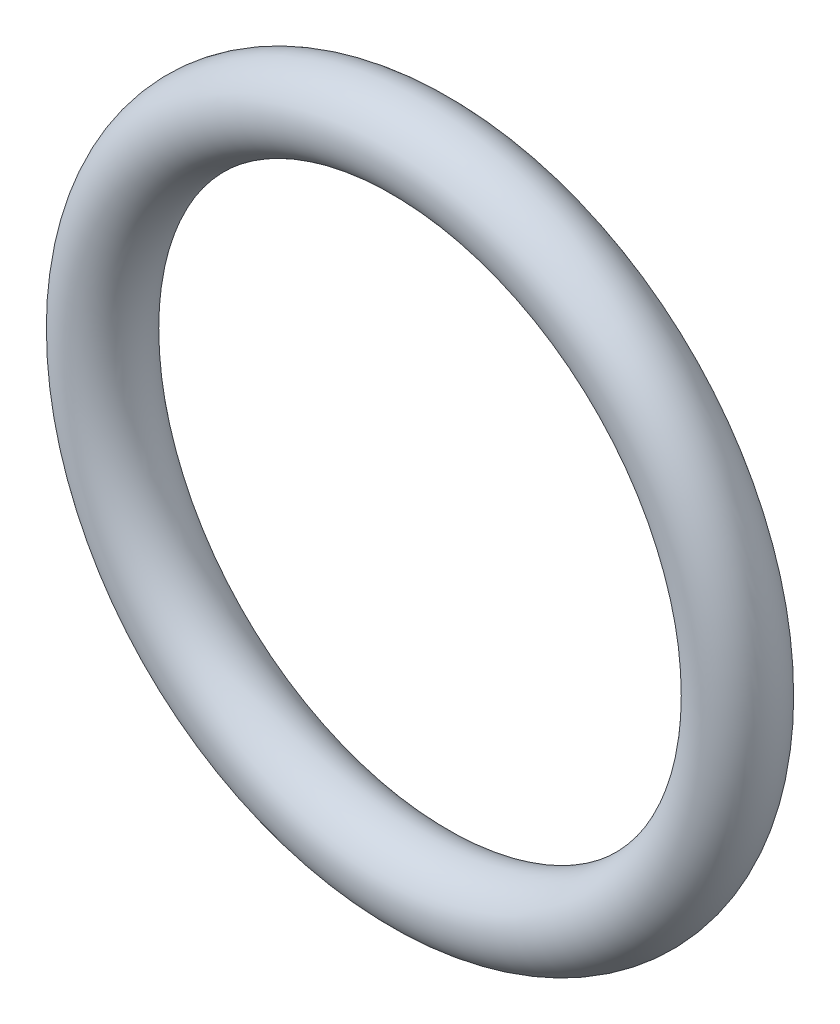
from build123d import *

# Parameters (mm, degrees)
SKETCH1_R = 0.889


with BuildPart() as part:
    # Sketch1 → Revolve1 (revolve)
    with BuildSketch(Plane(origin=(0, 0, 0), x_dir=(0, -1, 0), z_dir=(1, 0, 0)), mode=Mode.PRIVATE) as revolve1_sk:
        with Locations((7.0993, 0)):
            Circle(SKETCH1_R)
    revolve(revolve1_sk.sketch.rotate(Axis((0, 0, 0.889), (0, 0, -1)), 270), axis=Axis((0, 0, 0.889), (0, 0, -1)))


solid = part.part
